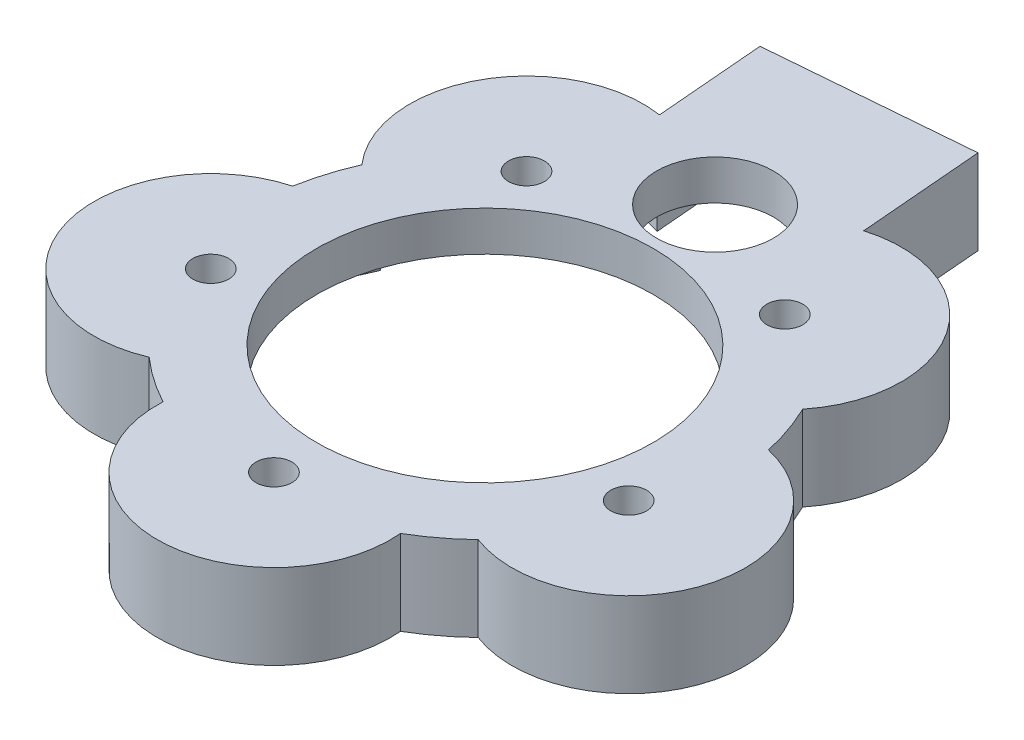
from build123d import *
from build123d.topology import SkipClean

# Parameters (mm, degrees)
SKETCH2_R           = 4
SKETCH2_R_2         = 13
SKETCH2_R_3         = 37.5
BOSS_EXTRUDE1_DEPTH = 8.9
BOSS_EXTRUDE2_START = 10
BOSS_EXTRUDE2_DEPTH = 10


with BuildPart() as part:
    # Sketch2 → Boss-Extrude1 (new body)
    with BuildSketch(Plane(origin=(0, -277.740590487, 0), x_dir=(1, 0, 0), z_dir=(0, 1, 0))):
        with BuildLine():
            Line((-53.878418828, 103.326067531), (-51.847327573, 78.891037586))
            ThreePointArc((-51.847327573, 78.891037586), (-78.565598454, 65.720224595), (-75.379791117, 36.102882626))
            ThreePointArc((-75.379791117, 36.102882626), (-77.51682206, 30.291074957), (-78.961404494, 24.269680499))
            ThreePointArc((-78.961404494, 24.269680499), (-96.690244613, -9.350450792), (-61.934509278, -24.73433396))
            ThreePointArc((-61.934509278, -24.73433396), (-57.067530602, -28.562718501), (-51.787244687, -31.797311256))
            ThreePointArc((-51.787244687, -31.797311256), (-25.291112632, -59.0476321), (0.079942571, -30.746844869))
            ThreePointArc((0.079942571, -30.746844869), (5.224931759, -27.301108969), (9.932910358, -23.278802773))
            ThreePointArc((9.932910358, -23.278802773), (44.037260658, -6.500295968), (24.961699769, 26.374435617))
            ThreePointArc((24.961699769, 26.374435617), (23.274499283, 32.332402061), (20.903904161, 38.052916758))
            ThreePointArc((20.903904161, 38.052916758), (22.229306824, 68.809494643), (-6.72372905, 79.271114455))
            Line((-6.72372905, 79.271114455), (-9.033076774, 107.053707002))
            Line((-9.033076774, 107.053707002), (-53.878418828, 103.326067531))
        make_face()
        with Locations(Location((-55.783755129, 53.190754745, 0), (0, 0, 90))):
            Circle(SKETCH2_R, mode=Mode.SUBTRACT)
        with Locations(Location((0.632059839, 54.33334451, 0), (0, 0, 90))):
            Circle(SKETCH2_R, mode=Mode.SUBTRACT)
        with Locations(Location((19.152172858, 1.031795718, 0), (0, 0, 90))):
            Circle(SKETCH2_R, mode=Mode.SUBTRACT)
        with Locations(Location((-25.81758279, -33.052962854, 0), (0, 0, 90))):
            Circle(SKETCH2_R, mode=Mode.SUBTRACT)
        with Locations(Location((-72.130533264, -0.816953357, 0), (0, 0, 90))):
            Circle(SKETCH2_R, mode=Mode.SUBTRACT)
        with Locations(Location((-28.345239753, 67.76894073, 0), (0, 0, 90))):
            Circle(SKETCH2_R_2, mode=Mode.SUBTRACT)
        with Locations(Location((-26.789527697, 14.937195752, 0), (0, 0, 90))):
            Circle(SKETCH2_R_3, mode=Mode.SUBTRACT)
    extrude(amount=BOSS_EXTRUDE1_DEPTH)

    # Sketch3 → Boss-Extrude2 (add)
    with SkipClean():  # the faces are left unmerged after this step: merging them gives an invalid solid
        with BuildSketch(Plane.XZ.offset(277.740590487).offset(BOSS_EXTRUDE2_START)):
            with BuildLine():
                Line((-51.847327573, -78.891037586), (-53.878418828, -103.326067531))
                Line((-53.878418828, -103.326067531), (-9.033076774, -107.053707002))
                Line((-9.033076774, -107.053707002), (-6.72372905, -79.271114455))
                ThreePointArc((-6.72372905, -79.271114455), (22.229306824, -68.809494643), (20.903904161, -38.052916758))
                ThreePointArc((20.903904161, -38.052916758), (23.274499283, -32.332402061), (24.961699769, -26.374435617))
                ThreePointArc((24.961699769, -26.374435617), (44.037260658, 6.500295968), (9.932910358, 23.278802773))
                ThreePointArc((9.932910358, 23.278802773), (5.224931759, 27.301108969), (0.079942571, 30.746844869))
                ThreePointArc((0.079942571, 30.746844869), (-25.291112632, 59.0476321), (-51.787244687, 31.797311256))
                ThreePointArc((-51.787244687, 31.797311256), (-57.067530602, 28.562718501), (-61.934509278, 24.73433396))
                ThreePointArc((-61.934509278, 24.73433396), (-96.690244613, 9.350450792), (-78.961404494, -24.269680499))
                ThreePointArc((-78.961404494, -24.269680499), (-77.51682206, -30.291074957), (-75.379791117, -36.102882626))
                ThreePointArc((-75.379791117, -36.102882626), (-78.565598454, -65.720224595), (-51.847327573, -78.891037586))
            make_face()
            with BuildLine():
                Line((-50.391710762, -97.595197888), (-12.285492603, -100.76266716))
                Line((-12.285492603, -100.76266716), (-10.116392703, -74.667325133))
                ThreePointArc((-10.116392703, -74.667325133), (18.958700221, -68.230619507), (17.311823606, -38.49713661))
                ThreePointArc((17.311823606, -38.49713661), (20.440686435, -31.347767742), (22.418959701, -23.798615955))
                ThreePointArc((22.418959701, -23.798615955), (41.165904374, 5.631208466), (9.245374606, 19.725259671))
                ThreePointArc((9.245374606, 19.725259671), (3.412792544, 24.910261532), (-3.155557396, 29.124527408))
                ThreePointArc((-3.155557396, 29.124527408), (-25.351859189, 56.048247187), (-48.620084596, 30.04532069))
                ThreePointArc((-48.620084596, 30.04532069), (-55.353681381, 26.100459204), (-61.39141816, 21.155866966))
                ThreePointArc((-61.39141816, 21.155866966), (-93.856431765, 8.365816472), (-76.316456157, -21.798927115))
                ThreePointArc((-76.316456157, -21.798927115), (-74.645465775, -29.421987455), (-71.808642379, -36.692179394))
                ThreePointArc((-71.808642379, -36.692179394), (-75.437352981, -65.137975823), (-48.514531786, -75.011808615))
                Line((-48.514531786, -75.011808615), (-50.391710762, -97.595197888))
            make_face(mode=Mode.SUBTRACT)
        extrude(amount=-BOSS_EXTRUDE2_DEPTH)


solid = part.part
